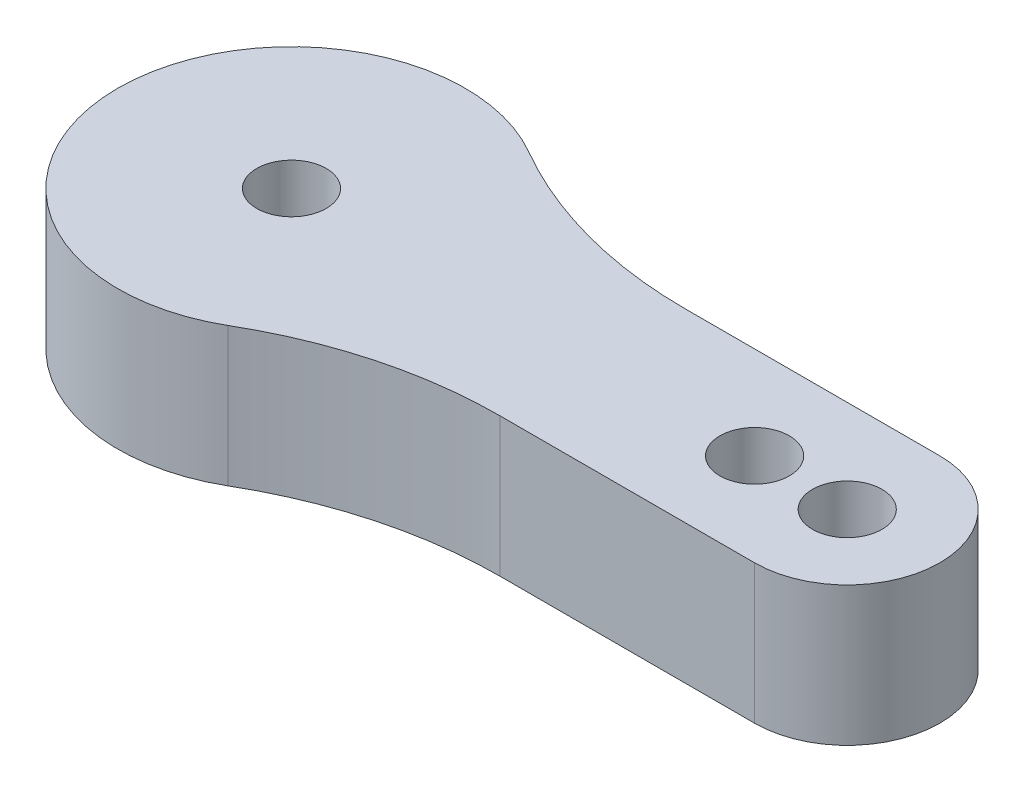
from build123d import *

# Parameters (mm, degrees)
SKETCH_3_R      = 1.5
EXTRUDE_1_DEPTH = 6


with BuildPart() as part:
    # 草图3 → 凸台-拉伸1 (new body)
    with BuildSketch(Plane(origin=(0, 0, 0), x_dir=(1, 0, 0), z_dir=(0, 1, 0))):
        with BuildLine():
            Line((16.368265324, 14), (5.368265324, 14))
            ThreePointArc((5.368265324, 14), (0.577950205, 14.634750338), (-3.881734676, 16.495190528))
            ThreePointArc((-3.881734676, 16.495190528), (-15.131734676, 10), (-3.881734676, 3.504809472))
            ThreePointArc((-3.881734676, 3.504809472), (0.577950205, 5.365249662), (5.368265324, 6))
            Line((5.368265324, 6), (16.368265324, 6))
            ThreePointArc((16.368265324, 6), (20.368265324, 10), (16.368265324, 14))
        make_face()
        with Locations(Location((-7.631734676, 10, 0), (0, 0, 270))):
            Circle(SKETCH_3_R, mode=Mode.SUBTRACT)
        with Locations(Location((12.368265324, 10, 0), (0, 0, 270))):
            Circle(SKETCH_3_R, mode=Mode.SUBTRACT)
        with Locations(Location((16.368265324, 10, 0), (0, 0, 270))):
            Circle(SKETCH_3_R, mode=Mode.SUBTRACT)
    extrude(amount=EXTRUDE_1_DEPTH)


solid = part.part
